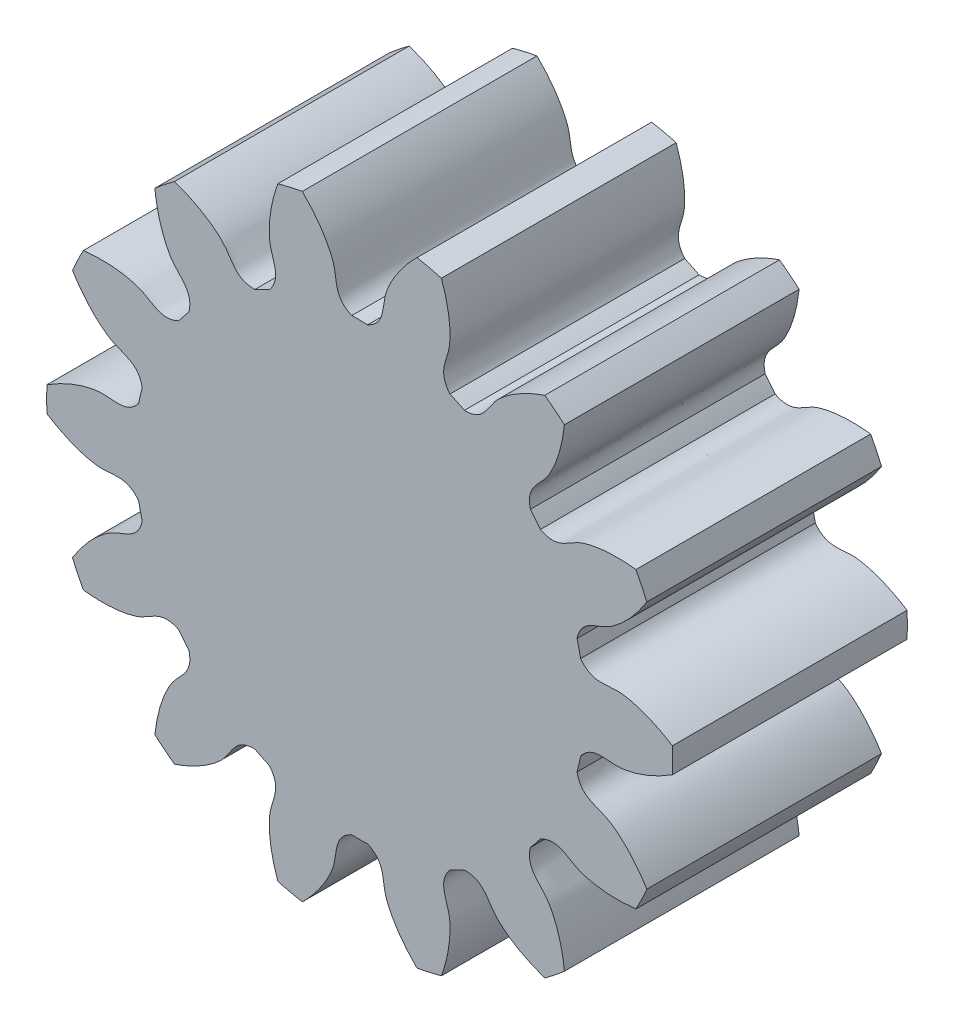
from build123d import *

# Parameters (mm, degrees)
SKETCH_1_R               = 4
EXTRUDE_1_DEPTH          = 3
CUT_EXTRUDE_1_DEPTH      = 7.403124237
PATTERN_CIRCULAR_1_COUNT = 14


with BuildPart() as part:
    # 草图1 → 凸台-拉伸1 (new body)
    with BuildSketch(Plane.XY):
        Circle(SKETCH_1_R)
    extrude(amount=EXTRUDE_1_DEPTH)

    # 草图2 → 切除-拉伸1 (cut, through all)
    with BuildSketch(Plane.XY):
        with BuildLine():
            ThreePointArc((0.10215715, 2.873184456), (0, 2.875), (-0.10215715, 2.873184456))
            add(Edge.make_bspline(
                [(-0.10215715, 2.873184456), (-0.323330347, 2.974011361), (-0.285874486, 3.15854782), (-0.331834469, 3.325704537), (-0.335384433, 3.337688234), (-0.339572539, 3.350852272), (-0.344446031, 3.365175672), (-0.350053163, 3.380635708), (-0.356441053, 3.397208295), (-0.363656288, 3.414867892), (-0.37174469, 3.433587549), (-0.38075134, 3.453338924), (-0.39072052, 3.474092297), (-0.401695681, 3.495816595), (-0.413719409, 3.518479414), (-0.426833384, 3.542047037), (-0.441078351, 3.566484464), (-0.456494079, 3.591755429), (-0.473119332, 3.61782243), (-0.490991832, 3.644646755), (-0.510148228, 3.672188504), (-0.530624064, 3.700406623), (-0.552453746, 3.729258928), (-0.575670511, 3.758702136), (-0.600306402, 3.788691895), (-0.62639223, 3.819182813), (-0.653957553, 3.850128493), (-0.683030643, 3.881481562), (-0.713638464, 3.913193704), (-0.74580664, 3.945215698), (-0.779559436, 3.977497445), (-0.814919726, 4.009988011), (-0.851908976, 4.042635655), (-0.890547219, 4.075387872), (-0.930853029, 4.108191423), (-0.972843509, 4.14099238), (-1.01653426, 4.173736157), (-1.061939371, 4.206367551), (-1.109071394, 4.238830784), (-1.157941332, 4.271069536), (-1.208558619, 4.303026991), (-1.260931107, 4.334645873), (-1.315065048, 4.365868491), (-1.370965088, 4.396636773), (-1.428634239, 4.426892317), (-1.50867182, 4.466862993), (-1.570186947, 4.495289718), (-1.611953727, 4.513605383)],
                knots=[0, 0, 0, 0, 0.215624359, 0.220482059, 0.225911253, 0.231911941, 0.238484123, 0.245627799, 0.253342969, 0.261629634, 0.270487792, 0.279917445, 0.289918591, 0.300491232, 0.311635367, 0.323350996, 0.335638119, 0.348496736, 0.361926847, 0.375928452, 0.390501552, 0.405646145, 0.421362233, 0.437649814, 0.45450889, 0.47193946, 0.489941524, 0.508515082, 0.527660134, 0.54737668, 0.56766472, 0.588524254, 0.609955283, 0.631957805, 0.654531822, 0.677677333, 0.701394337, 0.725682836, 0.750542829, 0.775974316, 0.801977297, 0.828551773, 0.855697742, 0.883415205, 0.911704163, 0.940564615, 1, 1, 1, 1], degree=3))
            ThreePointArc((-1.611953727, 4.513605383), (0, 4.792810071), (1.611953727, 4.513605383))
            add(Edge.make_bspline(
                [(0.10215715, 2.873184456), (0.323330347, 2.974011361), (0.285874486, 3.15854782), (0.331834469, 3.325704537), (0.335384433, 3.337688234), (0.339572539, 3.350852272), (0.344446031, 3.365175672), (0.350053163, 3.380635708), (0.356441053, 3.397208295), (0.363656288, 3.414867892), (0.37174469, 3.433587549), (0.38075134, 3.453338924), (0.39072052, 3.474092297), (0.401695681, 3.495816595), (0.413719409, 3.518479414), (0.426833384, 3.542047037), (0.441078351, 3.566484464), (0.456494079, 3.591755429), (0.473119332, 3.61782243), (0.490991832, 3.644646755), (0.510148228, 3.672188504), (0.530624064, 3.700406623), (0.552453746, 3.729258928), (0.575670511, 3.758702136), (0.600306402, 3.788691895), (0.62639223, 3.819182813), (0.653957553, 3.850128493), (0.683030643, 3.881481562), (0.713638464, 3.913193704), (0.74580664, 3.945215698), (0.779559436, 3.977497445), (0.814919726, 4.009988011), (0.851908976, 4.042635655), (0.890547219, 4.075387872), (0.930853029, 4.108191423), (0.972843509, 4.14099238), (1.01653426, 4.173736157), (1.061939371, 4.206367551), (1.109071394, 4.238830784), (1.157941332, 4.271069536), (1.208558619, 4.303026991), (1.260931107, 4.334645873), (1.315065048, 4.365868491), (1.370965088, 4.396636773), (1.428634239, 4.426892317), (1.50867182, 4.466862993), (1.570186947, 4.495289718), (1.611953727, 4.513605383)],
                knots=[0, 0, 0, 0, 0.215624359, 0.220482059, 0.225911253, 0.231911941, 0.238484123, 0.245627799, 0.253342969, 0.261629634, 0.270487792, 0.279917445, 0.289918591, 0.300491232, 0.311635367, 0.323350996, 0.335638119, 0.348496736, 0.361926847, 0.375928452, 0.390501552, 0.405646145, 0.421362233, 0.437649814, 0.45450889, 0.47193946, 0.489941524, 0.508515082, 0.527660134, 0.54737668, 0.56766472, 0.588524254, 0.609955283, 0.631957805, 0.654531822, 0.677677333, 0.701394337, 0.725682836, 0.750542829, 0.775974316, 0.801977297, 0.828551773, 0.855697742, 0.883415205, 0.911704163, 0.940564615, 1, 1, 1, 1], degree=3))
        make_face()
    cut_extrude_1 = extrude(amount=CUT_EXTRUDE_1_DEPTH, mode=Mode.SUBTRACT)

    # 阵列(圆周)1: 切除-拉伸1 ×14 about axis
    pattern_circular_1_axis = Axis((0, 0, -0.15), (0, 0, 1))
    for i in range(1, PATTERN_CIRCULAR_1_COUNT):
        add(cut_extrude_1.rotate(pattern_circular_1_axis, i * 360 / PATTERN_CIRCULAR_1_COUNT), mode=Mode.SUBTRACT)


solid = part.part
